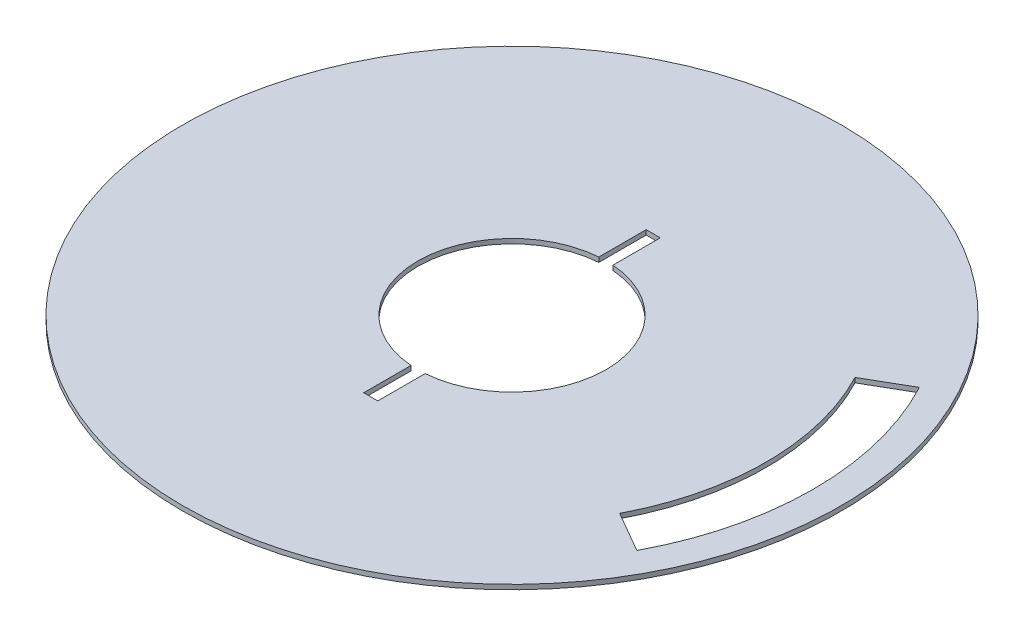
from build123d import *

# Parameters (mm, degrees)
IZIM1_R                     = 350
Y_KSEKLIK_EKSTR_ZYON2_DEPTH = 5


with BuildPart() as part:
    # Çizim1 → Yükseklik-Ekstrüzyon2 (new body)
    with BuildSketch(Plane(origin=(0, 0, 0), x_dir=(1, 0, 0), z_dir=(0, 1, 0))):
        with Locations(Location((0, 0, 0), (0, 0, 270))):
            Circle(IZIM1_R)
        with BuildLine():
            Line((7.5, -150), (7.5, -99.718353376))
            ThreePointArc((7.5, -99.718353376), (100, 0), (7.5, 99.718353376))
            Line((7.5, 99.718353376), (7.5, 150))
            Line((7.5, 150), (-7.5, 150))
            Line((-7.5, 150), (-7.5, 99.718353376))
            ThreePointArc((-7.5, 99.718353376), (-100, 0), (-7.5, -99.718353376))
            Line((-7.5, -99.718353376), (-7.5, -150))
            Line((-7.5, -150), (7.5, -150))
        make_face(mode=Mode.SUBTRACT)
        with BuildLine():
            Line((239.321958875, 125), (282.655877073, 150.018849336))
            ThreePointArc((282.655877073, 150.018849336), (320, 0), (282.655877073, -150.018849336))
            Line((282.655877073, -150.018849336), (239.321958875, -125))
            ThreePointArc((239.321958875, -125), (270, 0), (239.321958875, 125))
        make_face(mode=Mode.SUBTRACT)
    extrude(amount=Y_KSEKLIK_EKSTR_ZYON2_DEPTH)


solid = part.part
